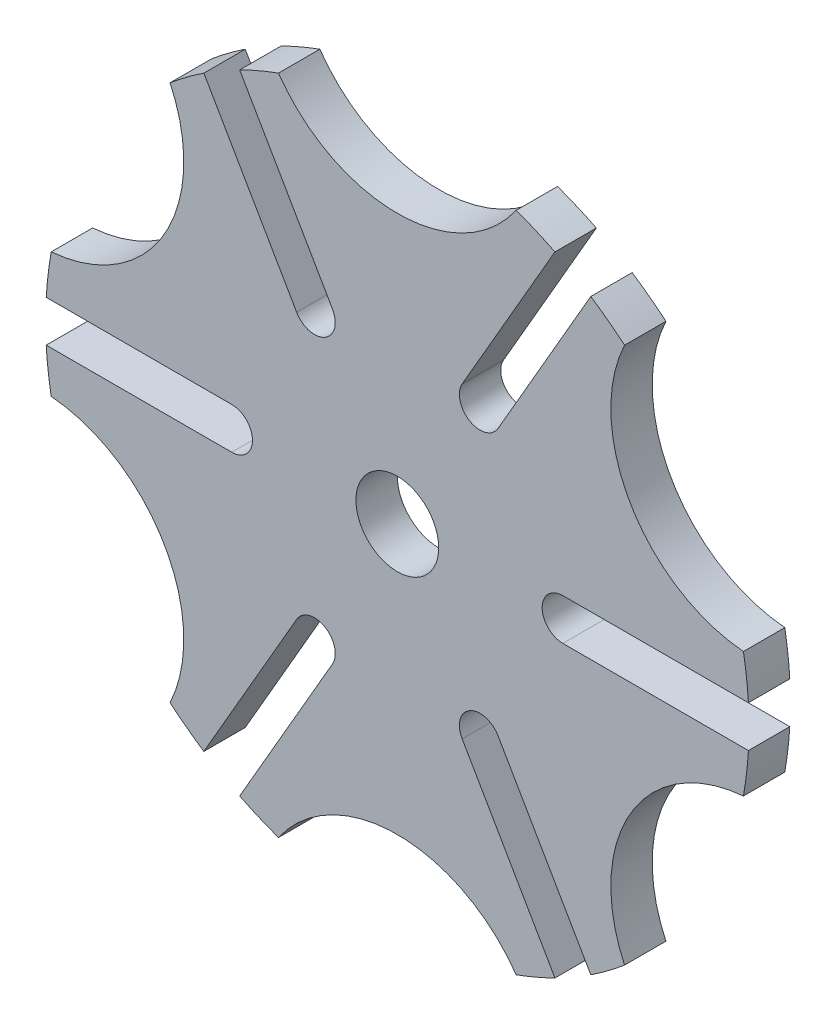
from build123d import *

# Parameters (mm, degrees)
CROQUIS1_R              = 85
SALIENTE_EXTRUIR3_DEPTH = 10
CROQUIS3_R              = 10
CORTAR_EXTRUIR1_DEPTH   = 10
CORTAR_EXTRUIR2_DEPTH   = 10
MATRIZC1_COUNT          = 6
CROQUIS5_R              = 35
CORTAR_EXTRUIR3_DEPTH   = 10
MATRIZC2_COUNT          = 6


with BuildPart() as part:
    # Croquis1 → Saliente-Extruir3 (new body)
    with BuildSketch(Plane.XY):
        Circle(CROQUIS1_R)
    extrude(amount=SALIENTE_EXTRUIR3_DEPTH)

    # Croquis3 → Cortar-Extruir1 (cut)
    with BuildSketch(Plane.XY.offset(10)):
        Circle(CROQUIS3_R)
    extrude(amount=-CORTAR_EXTRUIR1_DEPTH, mode=Mode.SUBTRACT)

    # Croquis4 → Cortar-Extruir2 (cut)
    with BuildSketch(Plane.XY.offset(10)):
        with BuildLine():
            Line((40, 5), (99.874921777, 5))
            ThreePointArc((99.874921777, 5), (100, 0), (99.874921777, -5))
            Line((99.874921777, -5), (40, -5))
            ThreePointArc((40, -5), (35, 0), (40, 5))
        make_face()
    cortar_extruir2 = extrude(amount=-CORTAR_EXTRUIR2_DEPTH, mode=Mode.SUBTRACT)

    # MatrizC1: Cortar-Extruir2 ×6 about axis
    matrizc1_axis = Axis((0, 0, 0), (0, 0, 1))
    for i in range(1, MATRIZC1_COUNT):
        add(cortar_extruir2.rotate(matrizc1_axis, i * 360 / MATRIZC1_COUNT), mode=Mode.SUBTRACT)

    # Croquis5 → Cortar-Extruir3 (cut)
    with BuildSketch(Plane.XY.offset(10)):
        with Locations((86.602540378, 50)):
            Circle(CROQUIS5_R)
    cortar_extruir3 = extrude(amount=-CORTAR_EXTRUIR3_DEPTH, mode=Mode.SUBTRACT)

    # MatrizC2: Cortar-Extruir3 ×6 about axis
    matrizc2_axis = Axis((0, 0, 0), (0, 0, 1))
    for i in range(1, MATRIZC2_COUNT):
        add(cortar_extruir3.rotate(matrizc2_axis, i * 360 / MATRIZC2_COUNT), mode=Mode.SUBTRACT)


solid = part.part
